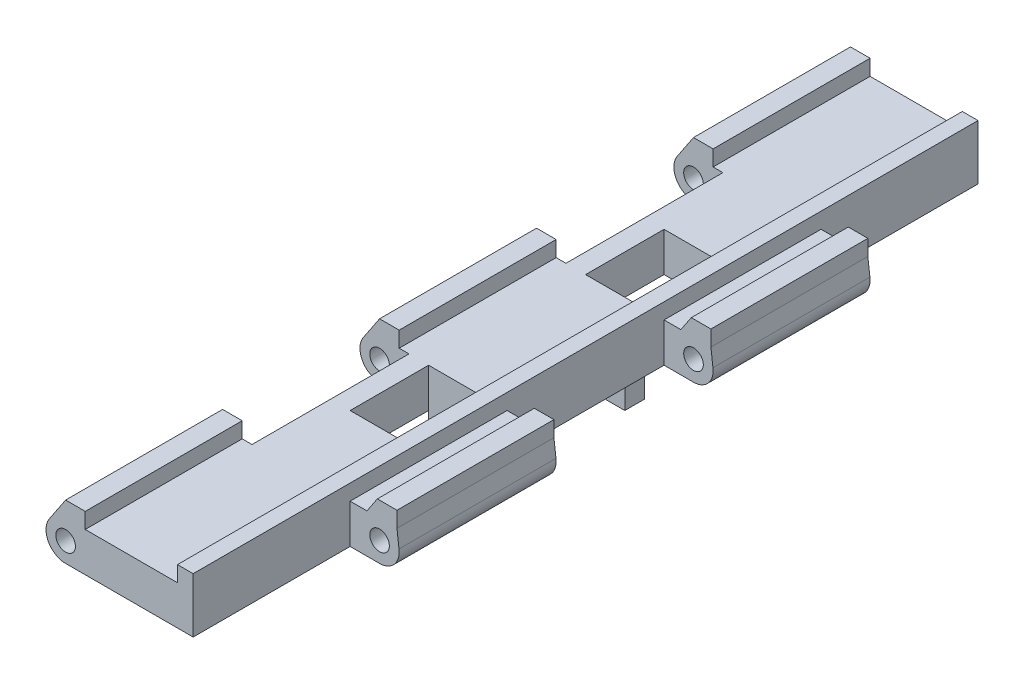
from build123d import *

# Parameters (mm, degrees)
EXTRUDE_1_DEPTH     = 40
SKETCH_3_R          = 0.5
CUT_EXTRUDE_1_DEPTH = 40
EXTRUDE_START       = -40
EXTRUDE_5_DEPTH     = 40
EXTRUDE_6_DEPTH     = 40
SKETCH_14_W         = 2.5
SKETCH_14_H         = 8
CUT_EXTRUDE_8_DEPTH = 40
SKETCH_15_W         = 3
SKETCH_15_H         = 4
CUT_EXTRUDE_9_DEPTH = 41.71781145
SKETCH_16_W         = 0.8
SKETCH_16_H         = 0.8
EXTRUDE_7_DEPTH     = 40
SKETCH_17_W         = 3
SKETCH_17_H         = 2
EXTRUDE_8_DEPTH     = 1
SKETCH_18_W         = 3
SKETCH_18_H         = 2
EXTRUDE_9_DEPTH     = 1


with BuildPart() as part:
    # 草图2 → 凸台-拉伸1 (new body)
    with BuildSketch(Plane.XY):
        with BuildLine():
            Line((-1.655607757, 0), (6.344392243, 0))
            ThreePointArc((6.344392243, 0), (7.344397132, 0.999995111), (6.344402021, 2))
            Line((6.344402021, 2), (-1.655607757, 2))
            ThreePointArc((-1.655607757, 2), (-2.655607757, 1), (-1.655607757, 0))
        make_face()
    extrude(amount=EXTRUDE_1_DEPTH)

    # 草图3 → 切除-拉伸1 (cut)
    with BuildSketch(Plane.XY.offset(40)):
        with Locations((-1.655607757, 1)):
            Circle(SKETCH_3_R)
        with Locations((6.344392243, 1.020580345)):
            Circle(SKETCH_3_R)
    extrude(amount=-CUT_EXTRUDE_1_DEPTH, mode=Mode.SUBTRACT)

    # 草图11 → 凸台-拉伸5 (add)
    with BuildSketch(Plane.XY.offset(40).offset(EXTRUDE_START)):
        with BuildLine():
            Line((-1.655607757, 2.8), (-0.655607757, 2.8))
            Line((-0.655607757, 2.8), (-0.655607757, 2))
            Line((-0.655607757, 2), (-1.655607757, 2))
            ThreePointArc((-1.655607757, 2), (-2.127012277, 1.881917104), (-2.487087176, 1.555555556))
            Line((-2.487087176, 1.555555556), (-1.655607757, 2.8))
        make_face()
    extrude(amount=EXTRUDE_5_DEPTH)

    # 草图12 → 凸台-拉伸6 (add)
    with BuildSketch(Plane.XY.offset(40).offset(EXTRUDE_START)):
        with BuildLine():
            Line((6.231808662, 1.993641704), (5.701534493, 2))
            Line((5.701534493, 2), (6.231808662, 2.793641704))
            Line((6.231808662, 2.793641704), (7.231808662, 2.793641704))
            Line((7.231808662, 2.793641704), (7.231808662, 1.993641704))
            Line((7.231808662, 1.993641704), (7.335350835, 1.134204168))
            ThreePointArc((7.335350835, 1.134204168), (7.043760809, 1.71476601), (6.456985603, 1.993641704))
            Line((6.456985603, 1.993641704), (6.231808662, 1.993641704))
        make_face()
    extrude(amount=EXTRUDE_6_DEPTH)

    # 草图14 → 切除-拉伸8 (cut)
    with BuildSketch(Plane(origin=(0, 0, 0), x_dir=(1, 0, 0), z_dir=(0, 1, 0))):
        with Locations((-1.405607757, -12)):
            Rectangle(SKETCH_14_W, SKETCH_14_H)
        with Locations((-1.405607757, -28)):
            Rectangle(SKETCH_14_W, SKETCH_14_H)
        with Locations((6.094397132, -4)):
            Rectangle(SKETCH_14_W, SKETCH_14_H)
        with Locations((6.094397132, -20)):
            Rectangle(SKETCH_14_W, SKETCH_14_H)
        with Locations((6.094397132, -36)):
            Rectangle(SKETCH_14_W, SKETCH_14_H)
    extrude(amount=CUT_EXTRUDE_8_DEPTH, mode=Mode.SUBTRACT)

    # 草图15 → 切除-拉伸9 (cut, through all)
    with BuildSketch(Plane(origin=(0, 2, 0), x_dir=(1, 0, 0), z_dir=(0, 1, 0))):
        with Locations((2.344392243, -14)):
            Rectangle(SKETCH_15_W, SKETCH_15_H)
        with Locations((2.344392243, -26)):
            Rectangle(SKETCH_15_W, SKETCH_15_H)
    extrude(amount=-CUT_EXTRUDE_9_DEPTH, mode=Mode.SUBTRACT)

    # 草图16 → 凸台-拉伸7 (add)
    with BuildSketch(Plane.XY.offset(40)):
        with Locations((4.444397132, 2.4)):
            Rectangle(SKETCH_16_W, SKETCH_16_H)
    extrude(amount=-EXTRUDE_7_DEPTH)

    # 草图17 → 凸台-拉伸8 (add)
    with BuildSketch(Plane.XY.offset(24)):
        with Locations((2.344392243, -1)):
            Rectangle(SKETCH_17_W, SKETCH_17_H)
    extrude(amount=-EXTRUDE_8_DEPTH)

    # 草图18 → 凸台-拉伸9 (add)
    with BuildSketch(Plane(origin=(0, 0, 16), x_dir=(-1, 0, 0), z_dir=(0, 0, -1))):
        with Locations((-2.344392243, -1)):
            Rectangle(SKETCH_18_W, SKETCH_18_H)
    extrude(amount=-EXTRUDE_9_DEPTH)


solid = part.part
